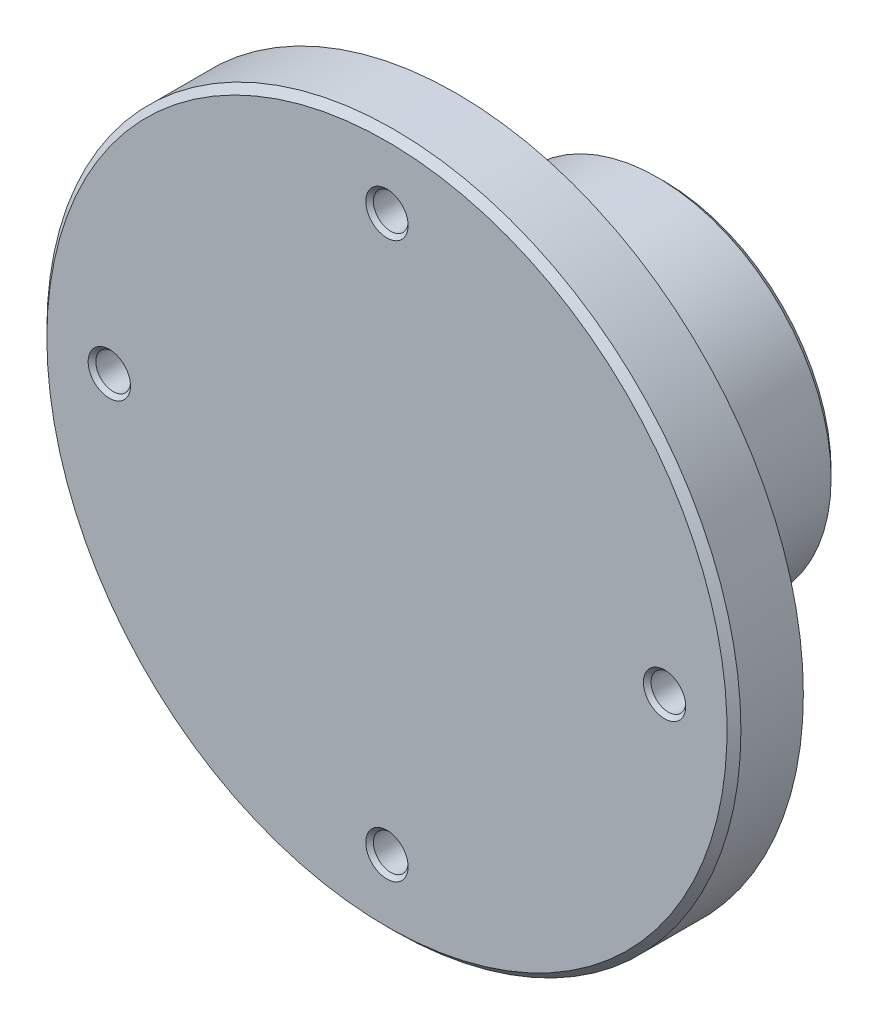
from build123d import *

# Parameters (mm, degrees)
HOLE_WIZARD_M10_1_D           = 8.5
HOLE_WIZARD_M10_1_DEPTH       = 12
HOLE_WIZARD_M10_1_CSINK_D     = 10.05
HOLE_WIZARD_M10_1_CSINK_ANGLE = 90
HOLE_WIZARD_M10_1_TIP         = 2.553657631
CHAMFER_1_SIZE                = 3
HOLE_WIZARD_M3_1_D            = 2.5
HOLE_WIZARD_M3_1_DEPTH        = 7.5
HOLE_WIZARD_M3_1_CSINK_D      = 3.05
HOLE_WIZARD_M3_1_CSINK_ANGLE  = 90
HOLE_WIZARD_M3_1_TIP          = 0.751075774
CHAMFER_2_SIZE                = 0.5


with BuildPart() as part:
    # 草图1 → 旋转1 (revolve)
    with BuildSketch(Plane(origin=(0, 0, 0), x_dir=(0, 0, -1), z_dir=(1, 0, 0)), mode=Mode.PRIVATE) as revolve_1_sk:
        Polygon((0, 0), (0, 25), (5, 25), (5, 12.5), (20, 12.5), (20, 0), align=None)
    revolve(revolve_1_sk.sketch.rotate(Axis((0, 0, 109.85915493), (0, 0, -1)), 90), axis=Axis((0, 0, 109.85915493), (0, 0, -1)))

    # M10 螺纹孔1
    with Locations(Plane(origin=(0, 0, -20), x_dir=(-1, 0, 0), z_dir=(0, 0, -1))):
        with Locations((0, 0)):
            CounterSinkHole(HOLE_WIZARD_M10_1_D / 2, HOLE_WIZARD_M10_1_CSINK_D / 2, depth=HOLE_WIZARD_M10_1_DEPTH, counter_sink_angle=HOLE_WIZARD_M10_1_CSINK_ANGLE)
            with Locations((0, 0, -(HOLE_WIZARD_M10_1_DEPTH + HOLE_WIZARD_M10_1_TIP / 2))):  # 118° drill point
                Cone(0, HOLE_WIZARD_M10_1_D / 2, HOLE_WIZARD_M10_1_TIP, mode=Mode.SUBTRACT)

    # 倒角1
    chamfer_1_edges = [part.edges().sort_by_distance(p)[0] for p in [
        (-12.5, 0, -5),
    ]]
    chamfer(chamfer_1_edges, length=CHAMFER_1_SIZE)

    # M3 螺纹孔1
    with Locations(Plane.XY):
        with Locations((-20, 0), (0, 20), (20, 0), (0, -20)):
            CounterSinkHole(HOLE_WIZARD_M3_1_D / 2, HOLE_WIZARD_M3_1_CSINK_D / 2, depth=HOLE_WIZARD_M3_1_DEPTH, counter_sink_angle=HOLE_WIZARD_M3_1_CSINK_ANGLE)
            with Locations((0, 0, -(HOLE_WIZARD_M3_1_DEPTH + HOLE_WIZARD_M3_1_TIP / 2))):  # 118° drill point
                Cone(0, HOLE_WIZARD_M3_1_D / 2, HOLE_WIZARD_M3_1_TIP, mode=Mode.SUBTRACT)

    # 倒角2
    chamfer_2_edges = [part.edges().sort_by_distance(p)[0] for p in [
        (-12.5, 0, -20),
        (-25, 0, 0),
    ]]
    chamfer(chamfer_2_edges, length=CHAMFER_2_SIZE)


solid = part.part
